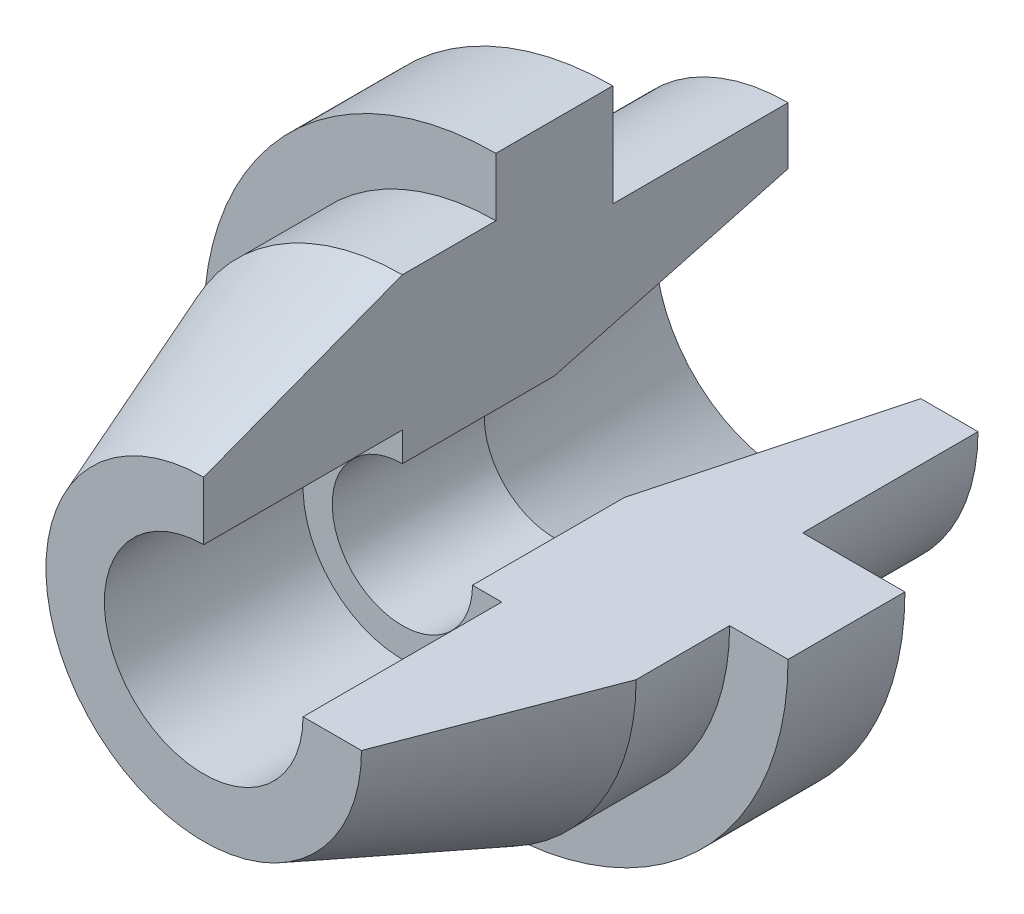
from build123d import *

# Parameters (mm, degrees)
REVOLVE1_ANGLE = 270


with BuildPart() as part:
    # Sketch1 → Revolve1 (revolve)
    with BuildSketch(Plane(origin=(0, 0, 0), x_dir=(0, 0, -1), z_dir=(1, 0, 0))):
        Polygon((0, 0), (0, 27), (34, 40), (50, 40), (50, 50), (70, 50), (70, 32.5), (100, 32.5), (100, 0), align=None)
    revolve(axis=Axis((0, 0, -100), (0, 0, 1)), revolution_arc=REVOLVE1_ANGLE)

    # Sketch3 → Cut-Revolve1 (revolve, cut)
    with BuildSketch(Plane(origin=(0, 0, 0), x_dir=(0, 0, -1), z_dir=(1, 0, 0))):
        Polygon((0, 17), (0, 0), (100, 0), (100, 22.717967697), (60, 12), (34, 12), (34, 17), align=None)
    revolve(axis=Axis((0, 0, 0), (0, 0, -1)), mode=Mode.SUBTRACT)


solid = part.part
